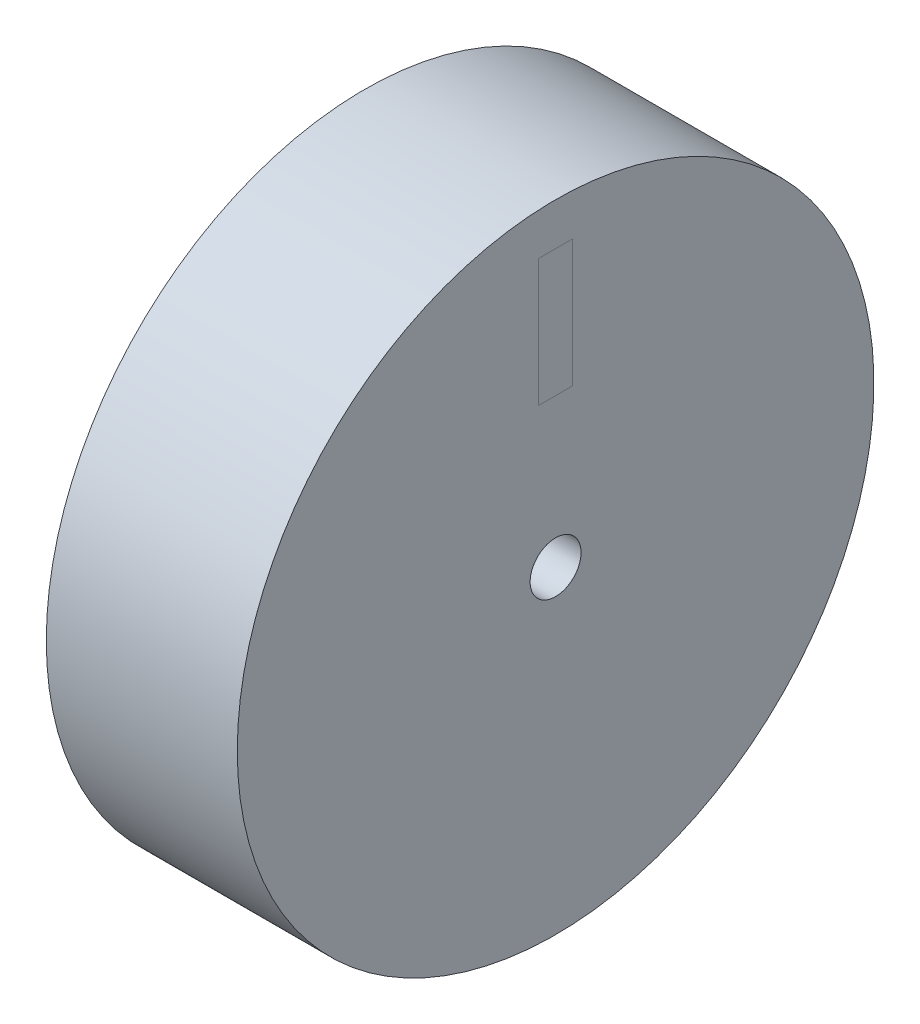
from build123d import *

# Parameters (mm, degrees)
SKETCH1_R           = 75
SKETCH1_R_2         = 6
BOSS_EXTRUDE1_DEPTH = 22.5


with BuildPart() as part:
    # Sketch1 → Boss-Extrude1 (new, symmetric)
    with BuildSketch(Plane(origin=(0, 0, 0), x_dir=(0, 0, -1), z_dir=(1, 0, 0))):
        with Locations(Location((0, 0, 0), (0, 0, 180))):
            Circle(SKETCH1_R)
        with Locations(Location((0, 0, 0), (0, 0, 180))):
            Circle(SKETCH1_R_2, mode=Mode.SUBTRACT)
    extrude(amount=BOSS_EXTRUDE1_DEPTH, both=True)


solid = part.part
